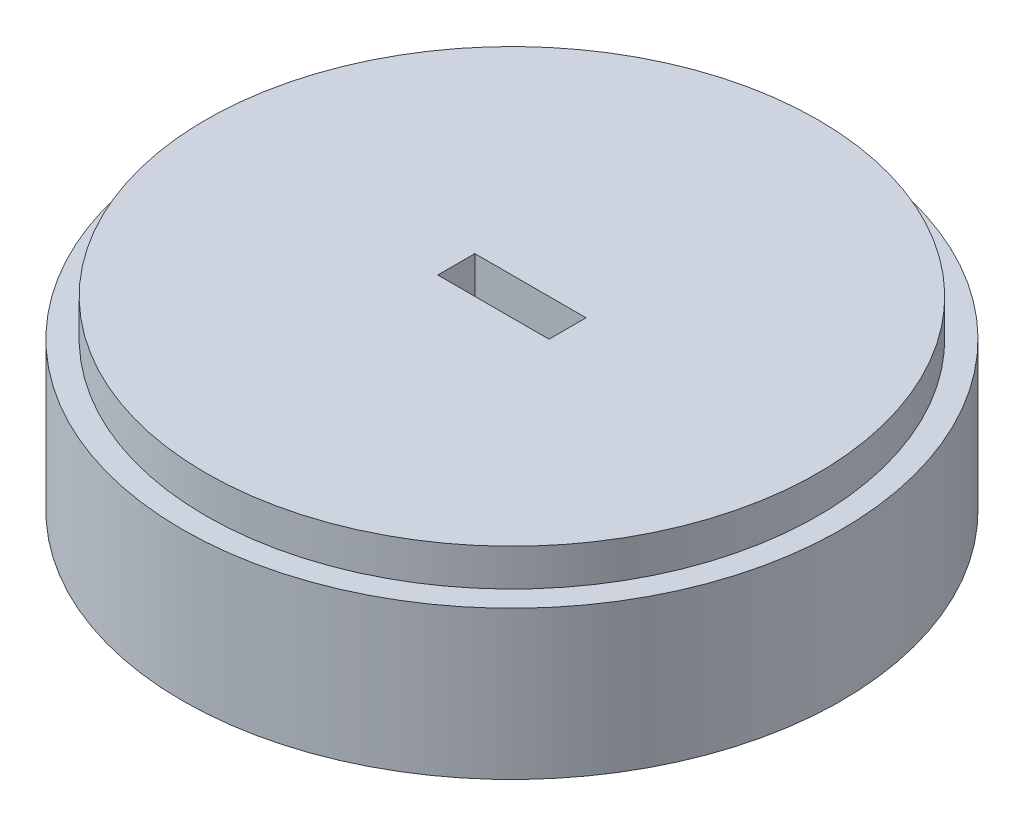
from build123d import *

# Parameters (mm, degrees)
SKETCH1_R           = 88.9
BOSS_EXTRUDE1_DEPTH = 40
SKETCH2_R           = 82.55
BOSS_EXTRUDE2_DEPTH = 10
SKETCH3_W           = 30
SKETCH3_H           = 35
CUT_EXTRUDE1_DEPTH  = 5


with BuildPart() as part:
    # Sketch1 → Boss-Extrude1 (new body)
    with BuildSketch(Plane(origin=(0, 0, 0), x_dir=(1, 0, 0), z_dir=(0, 1, 0))):
        with Locations(Location((0, 0, 0), (0, 0, 270))):
            Circle(SKETCH1_R)
    extrude(amount=BOSS_EXTRUDE1_DEPTH)

    # Sketch2 → Boss-Extrude2 (add)
    with BuildSketch(Plane(origin=(0, 40, 0), x_dir=(1, 0, 0), z_dir=(0, 1, 0))):
        with Locations(Location((0, 0, 0), (0, 0, 270))):
            Circle(SKETCH2_R)
    extrude(amount=BOSS_EXTRUDE2_DEPTH)

    # Sketch3 → Cut-Extrude1 (cut, symmetric)
    with BuildSketch(Plane.XY):
        with Locations((0, 32.5)):
            Rectangle(SKETCH3_W, SKETCH3_H)
    extrude(amount=CUT_EXTRUDE1_DEPTH, both=True, mode=Mode.SUBTRACT)


solid = part.part
